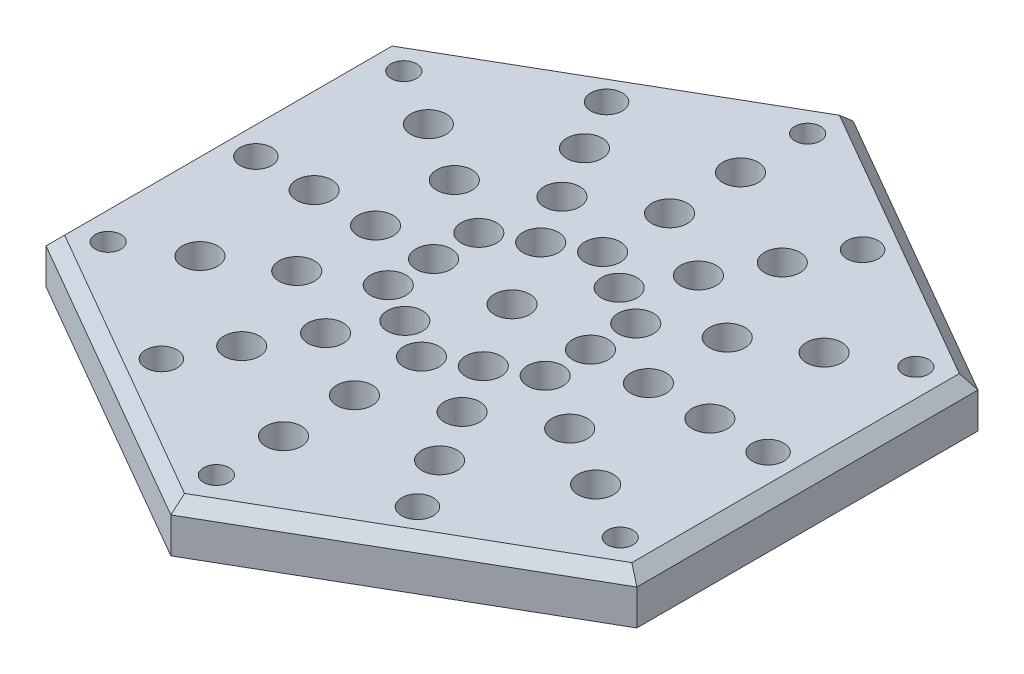
from build123d import *

# Parameters (mm, degrees)
EXTRUDE_2_DEPTH       = 12
CHAMFER_1_SIZE        = 3
F_6_0MM_1_D           = 6.5
F_8_0MM_1_D           = 8
F_6_0MM_2_D           = 9
F_6_0MM_2_ON_FACE_2_D = 9
F_6_0MM_3_D           = 9


with BuildPart() as part:
    # 草圖2 → 填料-伸長2 (new body)
    with BuildSketch(Plane(origin=(0, 0, 0), x_dir=(1, 0, 0), z_dir=(0, 1, 0))):
        Polygon((0, 86.602540378), (-75, 43.301270189), (-75, -43.301270189), (0, -86.602540378), (75, -43.301270189), (75, 43.301270189), align=None)
    extrude(amount=EXTRUDE_2_DEPTH)

    # 導角1
    chamfer_1_edges = [part.edges().sort_by_distance(p)[0] for p in [
        (-75, 12, 0),
        (-37.5, 12, 64.951905284),
        (37.5, 12, 64.951905284),
        (75, 12, 0),
        (37.5, 12, -64.951905284),
        (-37.5, 12, -64.951905284),
    ]]
    chamfer(chamfer_1_edges, length=CHAMFER_1_SIZE)

    # Ø6.0mm 定位孔1 (through all)
    with Locations(Plane(origin=(-65, 12, 37.527767497), x_dir=(0, 0, 1), z_dir=(0, 1, 0))):
        with Locations((0, 0), (-75.055534994, 0), (-112.583302492, 65), (-75.055534994, 130), (37.527767498, 65), (0, 130)):
            Hole(F_6_0MM_1_D / 2)

    # Ø8.0mm 定位孔1 (through all)
    with Locations(Plane(origin=(-65, 12, 0), x_dir=(0, 0, 1), z_dir=(0, 1, 0))):
        with Locations((0, 0), (56.5, 32.5), (56.5, 97.5), (-56.5, 97.5), (-56.5, 32.5), (0, 130)):
            Hole(F_8_0MM_1_D / 2)

    # Ø6.0mm 定位孔2 (through all)
    with Locations(Plane(origin=(-50.229473419, 12, -29), x_dir=(0, 0, 1), z_dir=(0, 1, 0))):
        with Locations((0, 0), (-14.5, 25.114736709), (-29, 50.229473419), (0, 100.458946838), (29, 100.458946838), (72.5, 75.344210129), (87, 50.229473419), (72.5, 25.114736709), (58, 0), (29, 0), (-11, 50.229473419), (9, 84.87048957), (-1, 67.549981495), (-1, 32.908965343), (9, 15.588457268), (17.5, 30.310889132), (11.75, 40.270181275), (6, 50.229473419), (11.75, 60.188765563), (17.5, 70.148057706), (29, 70.148057706), (46.25, 60.188765563), (52, 50.229473419), (46.25, 40.270181275), (40.5, 30.310889132), (49, 15.588457268), (29, 15.588457268), (59, 32.908965343), (69, 50.229473419), (59, 67.549981495), (49, 84.87048957), (29, 84.87048957), (29, 50.229473419)):
            Hole(F_6_0MM_2_D / 2)

    # Ø6.0mm 定位孔2 on face 2 (through all)
    with Locations(Plane(origin=(0, 0, 0), x_dir=(0, 0, -1), z_dir=(0, -1, 0))):
        with Locations((0, 0)):
            Hole(F_6_0MM_2_ON_FACE_2_D / 2)

    # Ø6.0mm 定位孔3 (through all)
    with Locations(Plane(origin=(25.11473671, 12, -43.5), x_dir=(0, 0, 1), z_dir=(0, 1, 0))):
        with Locations((0, 0), (72.5, 25.114736709), (55, -5.196152423), (43.5, -45.033320997)):
            Hole(F_6_0MM_3_D / 2)


solid = part.part
